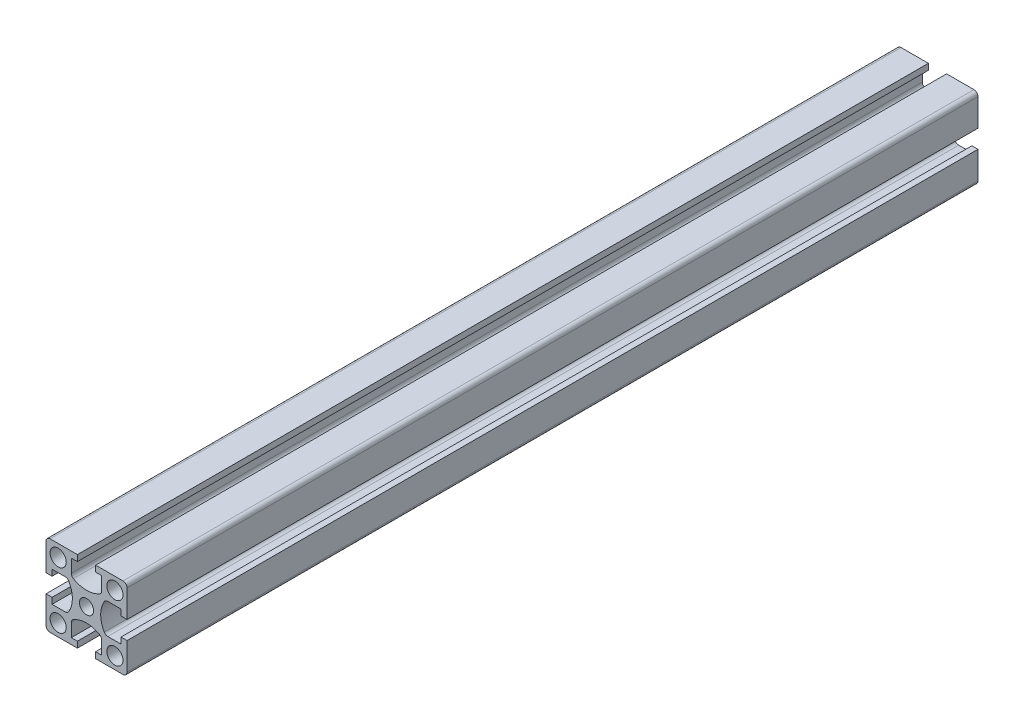
from build123d import *

# Parameters (mm, degrees)
SKETCH1_R           = 4
SKETCH1_R_2         = 3.5
BOSS_EXTRUDE1_DEPTH = 420


with BuildPart() as part:
    # Sketch1 → Boss-Extrude1 (new body)
    with BuildSketch(Plane.XY):
        with BuildLine():
            Line((-20, 18), (-20, 4.5))
            Line((-20, 4.5), (-17, 4.5))
            Line((-17, 4.5), (-17, 7.5))
            Line((-17, 7.5), (-10.473720558, 7.5))
            ThreePointArc((-10.473720558, 7.5), (-9.473720558, 7.232050808), (-8.741669751, 6.5))
            ThreePointArc((-8.741669751, 6.5), (-7, 0), (-8.741669751, -6.5))
            ThreePointArc((-8.741669751, -6.5), (-9.473720558, -7.232050808), (-10.473720558, -7.5))
            Line((-10.473720558, -7.5), (-17, -7.5))
            Line((-17, -7.5), (-17, -4.5))
            Line((-17, -4.5), (-20, -4.5))
            Line((-20, -4.5), (-20, -18))
            ThreePointArc((-20, -18), (-19.414213562, -19.414213562), (-18, -20))
            Line((-18, -20), (-4.5, -20))
            Line((-4.5, -20), (-4.5, -17))
            Line((-4.5, -17), (-7.5, -17))
            Line((-7.5, -17), (-7.5, -10.473720558))
            ThreePointArc((-7.5, -10.473720558), (-7.232050808, -9.473720558), (-6.5, -8.741669751))
            ThreePointArc((-6.5, -8.741669751), (0, -7), (6.5, -8.741669751))
            ThreePointArc((6.5, -8.741669751), (7.232050808, -9.473720558), (7.5, -10.473720558))
            Line((7.5, -10.473720558), (7.5, -17))
            Line((7.5, -17), (4.5, -17))
            Line((4.5, -17), (4.5, -20))
            Line((4.5, -20), (18, -20))
            ThreePointArc((18, -20), (19.414213562, -19.414213562), (20, -18))
            Line((20, -18), (20, -4.5))
            Line((20, -4.5), (17, -4.5))
            Line((17, -4.5), (17, -7.5))
            Line((17, -7.5), (10.473720558, -7.5))
            ThreePointArc((10.473720558, -7.5), (9.473720558, -7.232050808), (8.741669751, -6.5))
            ThreePointArc((8.741669751, -6.5), (7, 0), (8.741669751, 6.5))
            ThreePointArc((8.741669751, 6.5), (9.473720558, 7.232050808), (10.473720558, 7.5))
            Line((10.473720558, 7.5), (17, 7.5))
            Line((17, 7.5), (17, 4.5))
            Line((17, 4.5), (20, 4.5))
            Line((20, 4.5), (20, 18))
            ThreePointArc((20, 18), (19.414213562, 19.414213562), (18, 20))
            Line((18, 20), (4.5, 20))
            Line((4.5, 20), (4.5, 17))
            Line((4.5, 17), (7.5, 17))
            Line((7.5, 17), (7.5, 10.473720558))
            ThreePointArc((7.5, 10.473720558), (7.232050808, 9.473720558), (6.5, 8.741669751))
            ThreePointArc((6.5, 8.741669751), (0, 7), (-6.5, 8.741669751))
            ThreePointArc((-6.5, 8.741669751), (-7.232050808, 9.473720558), (-7.5, 10.473720558))
            Line((-7.5, 10.473720558), (-7.5, 17))
            Line((-7.5, 17), (-4.5, 17))
            Line((-4.5, 17), (-4.5, 20))
            Line((-4.5, 20), (-18, 20))
            ThreePointArc((-18, 20), (-19.414213562, 19.414213562), (-20, 18))
        make_face()
        with Locations((-14, -14)):
            Circle(SKETCH1_R, mode=Mode.SUBTRACT)
        with Locations((14, -14)):
            Circle(SKETCH1_R, mode=Mode.SUBTRACT)
        with Locations((14, 14)):
            Circle(SKETCH1_R, mode=Mode.SUBTRACT)
        Circle(SKETCH1_R_2, mode=Mode.SUBTRACT)
        with Locations((-14, 14)):
            Circle(SKETCH1_R, mode=Mode.SUBTRACT)
    extrude(amount=BOSS_EXTRUDE1_DEPTH)


solid = part.part
